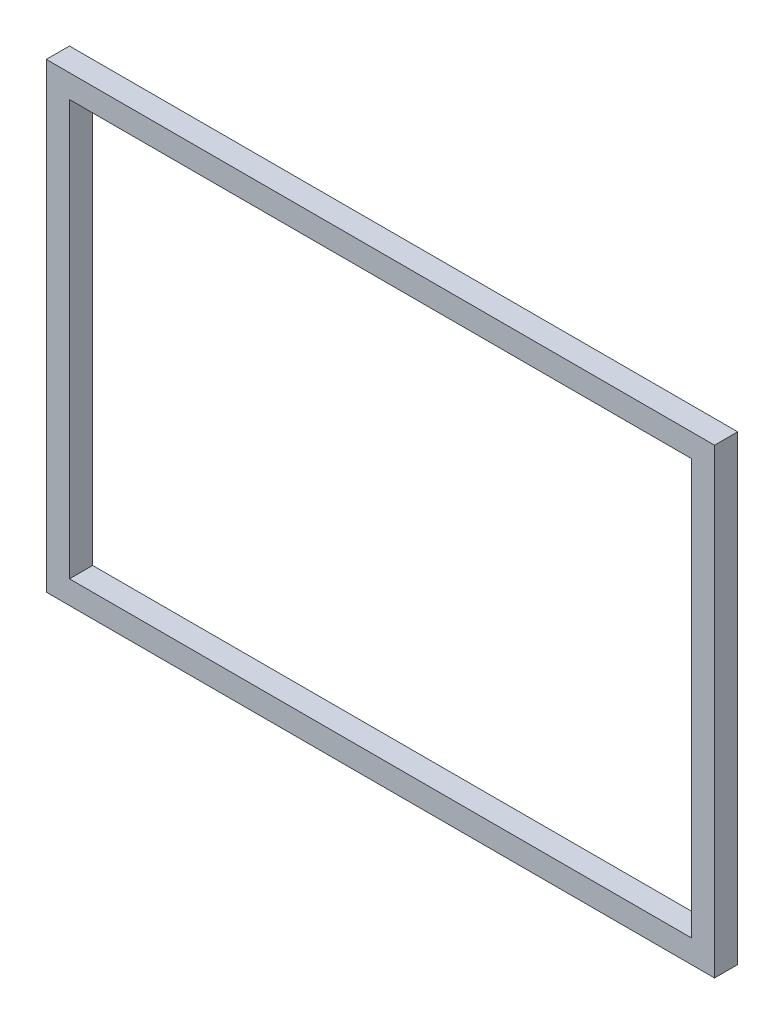
from build123d import *

# Parameters (mm, degrees)
SKETCH1_W           = 91.57
SKETCH1_H           = 63.23
SKETCH1_W_2         = 85.22
SKETCH1_H_2         = 56.88
BOSS_EXTRUDE1_DEPTH = 3.175


with BuildPart() as part:
    # Sketch1 → Boss-Extrude1 (new body)
    with BuildSketch(Plane.XY):
        Rectangle(SKETCH1_W, SKETCH1_H)
        Rectangle(SKETCH1_W_2, SKETCH1_H_2, mode=Mode.SUBTRACT)
    extrude(amount=BOSS_EXTRUDE1_DEPTH)


solid = part.part
